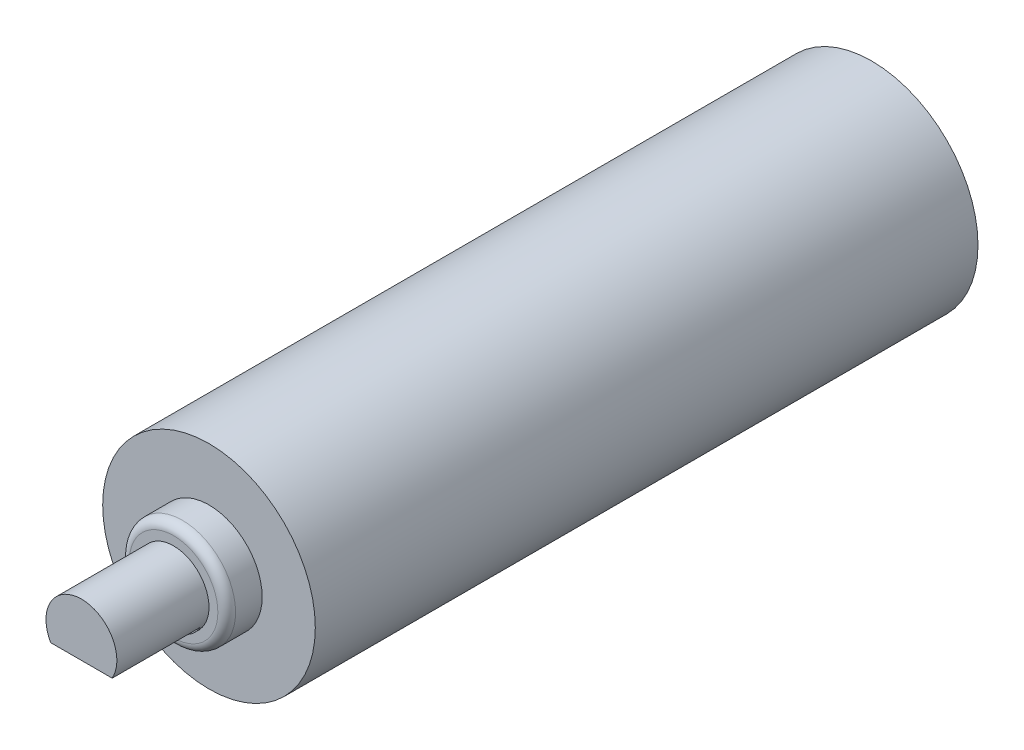
from build123d import *

# Parameters (mm, degrees)
SKETCH_1_R          = 3
EXTRUDE_1_DEPTH     = 18.7
SKETCH_2_R          = 1.5
EXTRUDE_2_DEPTH     = 1
SKETCH_3_R          = 1
EXTRUDE_3_DEPTH     = 2.6
CUT_EXTRUDE_1_DEPTH = 2.5
FILLET_1_R          = 0.25


with BuildPart() as part:
    # 草图1 → 凸台-拉伸1 (new body)
    with BuildSketch(Plane.XY):
        Circle(SKETCH_1_R)
    extrude(amount=-EXTRUDE_1_DEPTH)

    # 草图2 → 凸台-拉伸2 (add)
    with BuildSketch(Plane.XY):
        Circle(SKETCH_2_R)
    extrude(amount=EXTRUDE_2_DEPTH)

    # 草图3 → 凸台-拉伸3 (add)
    with BuildSketch(Plane.XY.offset(1)):
        Circle(SKETCH_3_R)
    extrude(amount=EXTRUDE_3_DEPTH)

    # 草图4 → 切除-拉伸1 (cut)
    with BuildSketch(Plane.XY.offset(3.6)):
        Polygon((0, -0.5), (0.862464595, -0.5), (0.862464595, -1), (0, -1), (-0.86936686, -1), (-0.86936686, -0.5), align=None)
    extrude(amount=-CUT_EXTRUDE_1_DEPTH, mode=Mode.SUBTRACT)

    # 圆角1
    fillet_1_edges = [part.edges().sort_by_distance(p)[0] for p in [
        (-1.5, 0, 1),
    ]]
    fillet(fillet_1_edges, radius=FILLET_1_R)


solid = part.part
